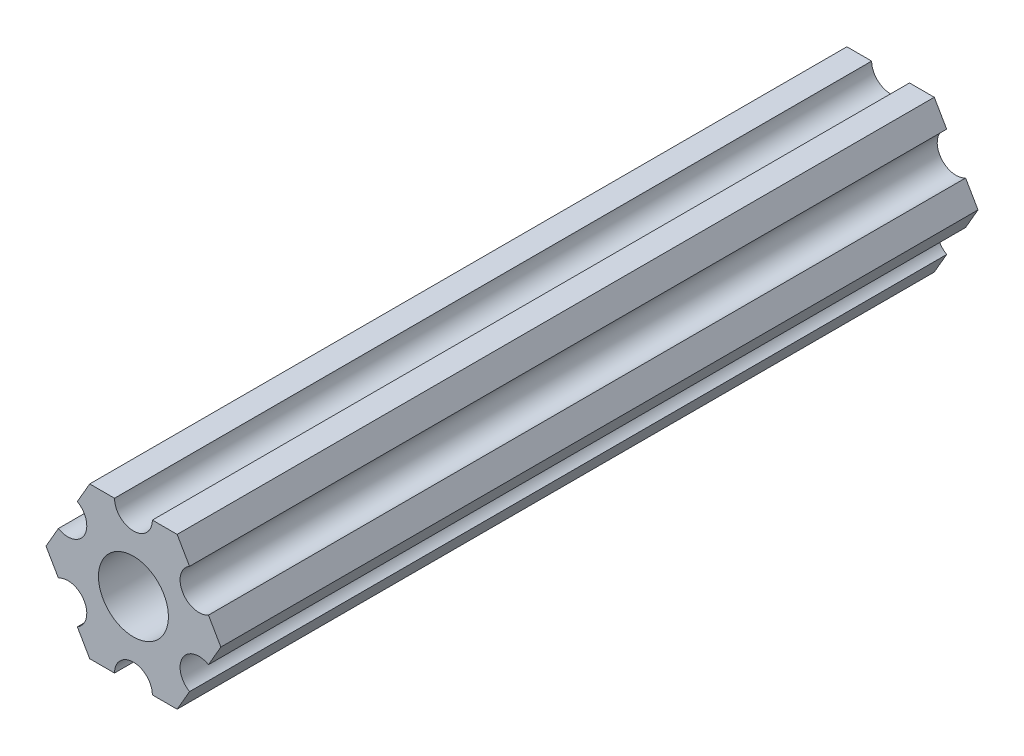
from build123d import *

# Parameters (mm, degrees)
SKETCH1_R           = 2.9337
BOSS_EXTRUDE1_DEPTH = 63.5


with BuildPart() as part:
    # Sketch1 → Boss-Extrude1 (new body)
    with BuildSketch(Plane.XY.offset(304.8)):
        with BuildLine():
            Line((6.293011699, -1.800184894), (7.332348803, -2.22e-07))
            Line((7.332348803, -2.22e-07), (6.293011439, 1.800184522))
            ThreePointArc((6.293011439, 1.800184522), (4.124446058, 2.381249653), (4.705511189, 4.549815034))
            Line((4.705511189, 4.549815034), (3.666173825, 6.349999778))
            Line((3.666173825, 6.349999778), (1.587499615, 6.349999778))
            ThreePointArc((1.587499615, 6.349999778), (-3.85e-07, 4.762499778), (-1.587500385, 6.349999778))
            Line((-1.587500385, 6.349999778), (-3.666174594, 6.349999778))
            Line((-3.666174594, 6.349999778), (-4.70551159, 4.549815043))
            ThreePointArc((-4.70551159, 4.549815043), (-4.12444613, 2.38124975), (-6.293011423, 1.80018429))
            Line((-6.293011423, 1.80018429), (-7.332348419, -4.44e-07))
            Line((-7.332348419, -4.44e-07), (-6.293011205, -1.800185053))
            ThreePointArc((-6.293011205, -1.800185053), (-4.124445841, -2.38125025), (-4.705511038, -4.549815614))
            Line((-4.705511038, -4.549815614), (-3.666173825, -6.350000222))
            Line((-3.666173825, -6.350000222), (-1.587499615, -6.350000222))
            ThreePointArc((-1.587499615, -6.350000222), (3.85e-07, -4.762500222), (1.587500385, -6.350000222))
            Line((1.587500385, -6.350000222), (3.666174594, -6.350000222))
            Line((3.666174594, -6.350000222), (4.705511699, -4.549815551))
            ThreePointArc((4.705511699, -4.549815551), (4.12444637, -2.381250222), (6.293011699, -1.800184894))
        make_face()
        with Locations(Location((0, 0, 0), (0, 0, 180))):
            Circle(SKETCH1_R, mode=Mode.SUBTRACT)
    extrude(amount=-BOSS_EXTRUDE1_DEPTH)


solid = part.part
